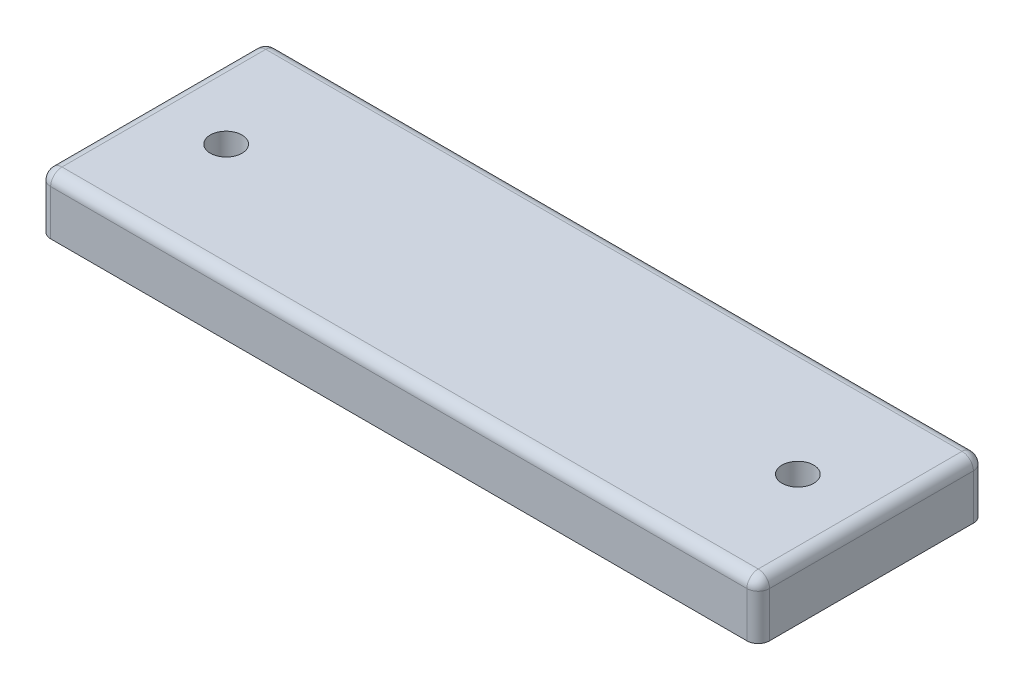
from build123d import *

# Parameters (mm, degrees)
SKETCH1_W            = 63.5
SKETCH1_H            = 20
SKETCH1_R            = 1.4
BASE_DEPTH           = 5
F_1MM_EDGE_FILLETS_R = 1


with BuildPart() as part:
    # Sketch1 → Base (new body)
    with BuildSketch(Plane(origin=(0, 0, 0), x_dir=(1, 0, 0), z_dir=(0, 1, 0))):
        Rectangle(SKETCH1_W, SKETCH1_H)
        with Locations((-25.25, 0)):
            Circle(SKETCH1_R, mode=Mode.SUBTRACT)
        with Locations((25.25, 0)):
            Circle(SKETCH1_R, mode=Mode.SUBTRACT)
    extrude(amount=BASE_DEPTH)

    # 1mm Edge Fillets
    f_1mm_edge_fillets_edges = [part.edges().sort_by_distance(p)[0] for p in [
        (-31.75, 2.5, -10),
        (0, 5, -10),
        (31.75, 2.5, -10),
        (31.75, 2.5, 10),
        (31.75, 5, 0),
        (-31.75, 5, 0),
        (0, 5, 10),
        (-31.75, 2.5, 10),
    ]]
    fillet(f_1mm_edge_fillets_edges, radius=F_1MM_EDGE_FILLETS_R)


solid = part.part
